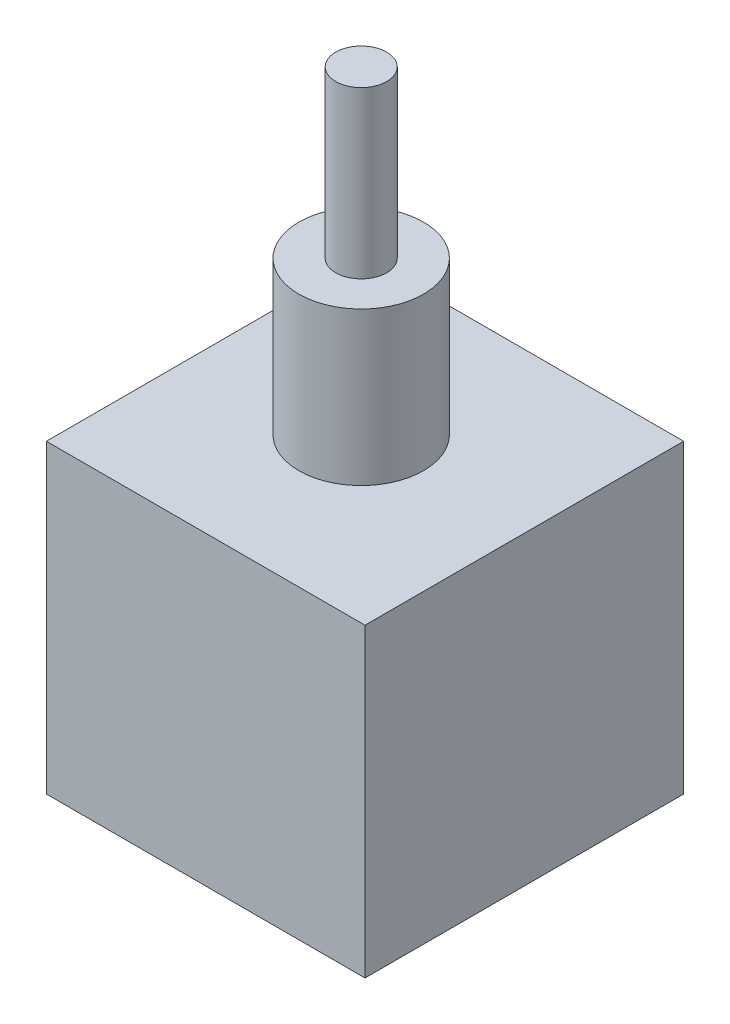
from build123d import *

# Parameters (mm, degrees)
SKETCH_1_W          = 30
SKETCH_1_H          = 30
EXTRUDE_283_DEPTH   = 28.77
SKETCH_2_R          = 5.875
EXTRUDE_2_DEPTH     = 14.4
SKETCH_4_R          = 2.4
EXTRUDE_3_DEPTH     = 15.6
SKETCH_5_R          = 2.5
CUT_EXTRUDE_2_DEPTH = 15


with BuildPart() as part:
    # Эскиз1 → Extrude 283 (new body)
    with BuildSketch(Plane(origin=(0, 0, 0), x_dir=(1, 0, 0), z_dir=(0, 1, 0))):
        with Locations((0.713469456, -0.356734728)):
            Rectangle(SKETCH_1_W, SKETCH_1_H)
    extrude(amount=EXTRUDE_283_DEPTH)

    # Эскиз2 → Бобышка-Вытянуть2 (add)
    with BuildSketch(Plane(origin=(0, 28.77, 0), x_dir=(1, 0, 0), z_dir=(0, 1, 0))):
        with Locations(Location((0, 0, 0), (0, 0, 270))):
            Circle(SKETCH_2_R)
    extrude(amount=EXTRUDE_2_DEPTH)

    # Эскиз4 → Бобышка-Вытянуть3 (add)
    with BuildSketch(Plane(origin=(0, 43.17, 0), x_dir=(1, 0, 0), z_dir=(0, 1, 0))):
        with Locations(Location((0, 0, 0), (0, 0, 270))):
            Circle(SKETCH_4_R)
    extrude(amount=EXTRUDE_3_DEPTH)

    # Эскиз5 → Вырез-Вытянуть2 (cut)
    with BuildSketch(Plane.XZ):
        with Locations(Location((8, 0, 0), (0, 0, 270))):
            Circle(SKETCH_5_R)
        with Locations(Location((-8, 0, 0), (0, 0, 90))):
            Circle(SKETCH_5_R)
    extrude(amount=-CUT_EXTRUDE_2_DEPTH, mode=Mode.SUBTRACT)


solid = part.part
